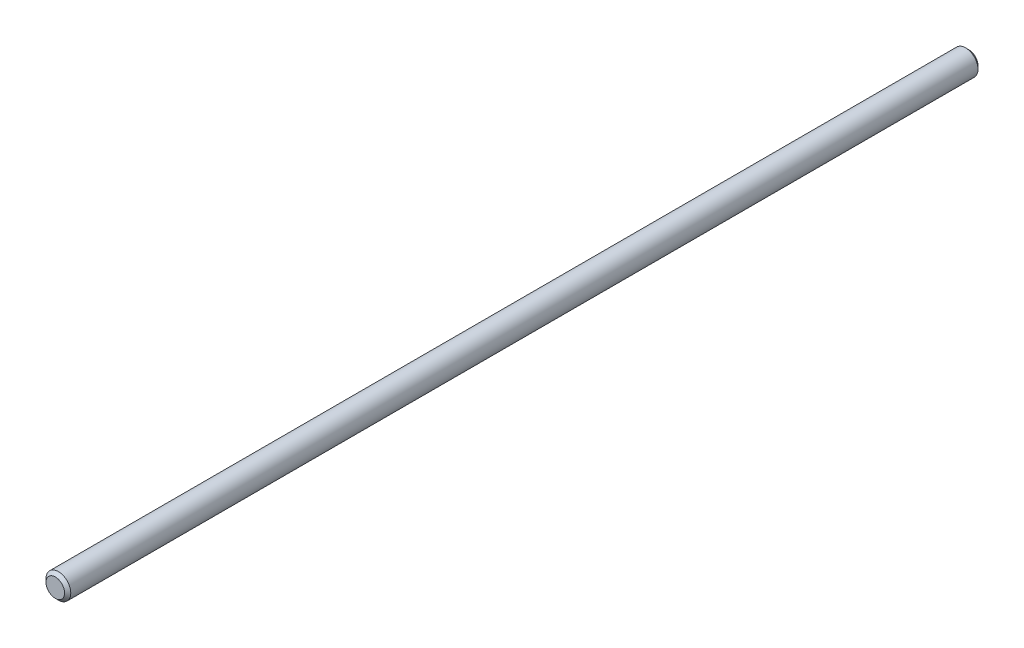
from build123d import *

# Parameters (mm, degrees)
SKETCH1_R           = 4
BOSS_EXTRUDE1_DEPTH = 295
CHAMFER1_SIZE       = 1


with BuildPart() as part:
    # Sketch1 → Boss-Extrude1 (new body)
    with BuildSketch(Plane.XY):
        Circle(SKETCH1_R)
    extrude(amount=BOSS_EXTRUDE1_DEPTH)

    # Chamfer1
    chamfer1_edges = [part.edges().sort_by_distance(p)[0] for p in [
        (-4, 0, 0),
        (-4, 0, 295),
    ]]
    chamfer(chamfer1_edges, length=CHAMFER1_SIZE)


solid = part.part
